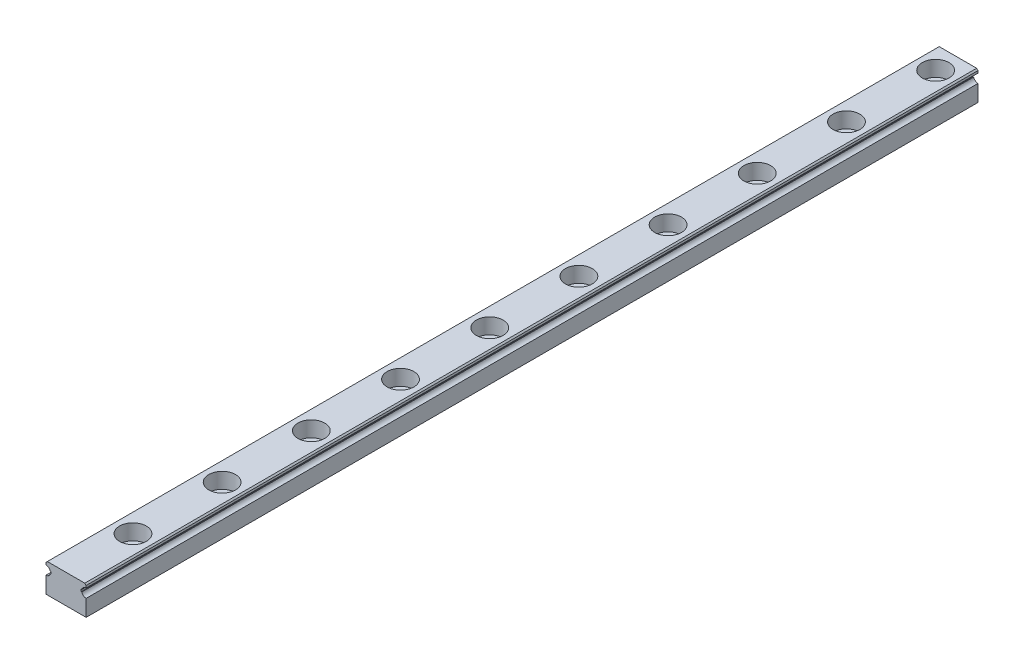
from build123d import *

# Parameters (mm, degrees)
EXTRUDE1_DEPTH  = 200
SKETCH2_R       = 3
EXTRUDE2_DEPTH  = 3.5
SKETCH_R        = 1.75
EXTRUDE3_DEPTH  = 201.156189012
LPATTERN1_COUNT = 40
LPATTERN1_PITCH = 20
CHAMFER1_SIZE   = 0.3


with BuildPart() as part:
    # Sketch1 → Extrude1 (new body)
    with BuildSketch(Plane.XY):
        with BuildLine():
            Line((-4.5, -3.25), (4.5, -3.25))
            Line((4.5, -3.25), (4.5, 0.45))
            ThreePointArc((4.5, 0.45), (3.887627564, 0.659430585), (3.531754163, 1.2))
            Line((3.531754163, 1.2), (3.4, 1.2))
            Line((3.4, 1.2), (3.4, 1.7))
            Line((3.4, 1.7), (3.531754163, 1.7))
            ThreePointArc((3.531754163, 1.7), (3.887627564, 2.240569415), (4.5, 2.45))
            Line((4.5, 2.45), (4.5, 3.25))
            Line((4.5, 3.25), (-4.5, 3.25))
            Line((-4.5, 3.25), (-4.5, 2.45))
            ThreePointArc((-4.5, 2.45), (-3.887627564, 2.240569415), (-3.531754163, 1.7))
            Line((-3.531754163, 1.7), (-3.4, 1.7))
            Line((-3.4, 1.7), (-3.4, 1.2))
            Line((-3.4, 1.2), (-3.531754163, 1.2))
            ThreePointArc((-3.531754163, 1.2), (-3.887627564, 0.659430585), (-4.5, 0.45))
            Line((-4.5, 0.45), (-4.5, -3.25))
        make_face()
    extrude(amount=EXTRUDE1_DEPTH)

    # Sketch2 → Extrude2 (cut)
    with BuildSketch(Plane(origin=(0, 3.25, 0), x_dir=(1, 0, 0), z_dir=(0, 1, 0))):
        with Locations((0, -5)):
            Circle(SKETCH2_R)
    extrude2 = extrude(amount=-EXTRUDE2_DEPTH, mode=Mode.SUBTRACT)

    # Sketch → Extrude3 (cut, through all)
    with BuildSketch(Plane(origin=(0, 3.25, 0), x_dir=(1, 0, 0), z_dir=(0, 1, 0))):
        with Locations((0, -5)):
            Circle(SKETCH_R)
    extrude3 = extrude(amount=-EXTRUDE3_DEPTH, mode=Mode.SUBTRACT)

    # LPattern1: Extrude2, Extrude3 ×40
    with Locations(*[(0, 0, i * LPATTERN1_PITCH) for i in range(1, LPATTERN1_COUNT)]):
        add(extrude2, mode=Mode.SUBTRACT)
        add(extrude3, mode=Mode.SUBTRACT)

    # Chamfer1
    chamfer1_edges = [part.edges().sort_by_distance(p)[0] for p in [
        (4.5, 3.25, 100),
        (-4.5, 3.25, 100),
    ]]
    chamfer(chamfer1_edges, length=CHAMFER1_SIZE)


solid = part.part
